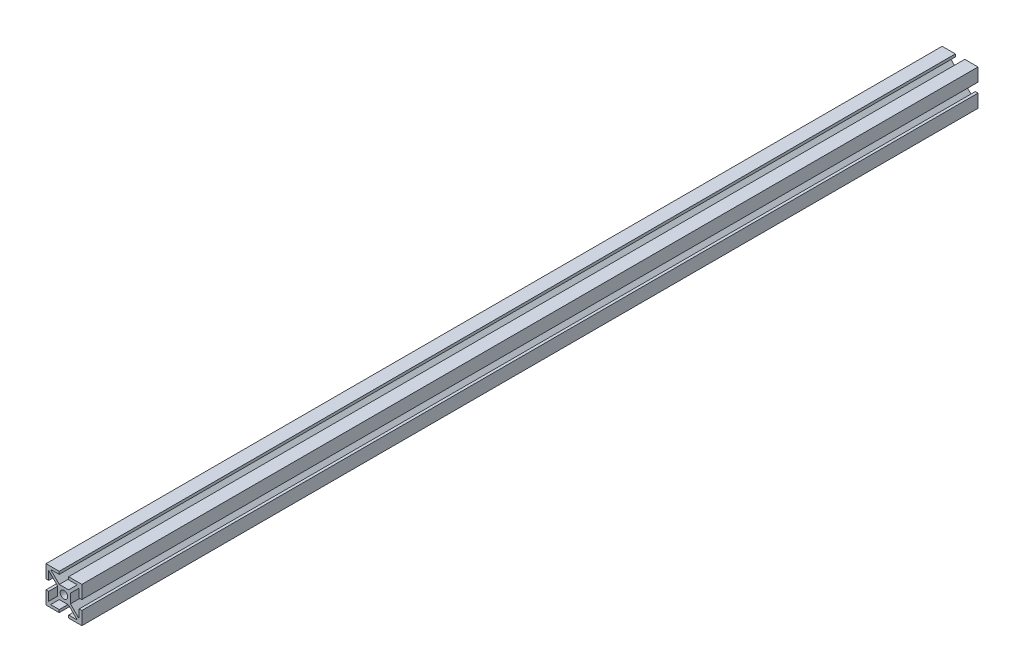
from build123d import *

# Parameters (mm, degrees)
SKETCH1_R           = 2.095
BOSS_EXTRUDE1_DEPTH = 500


with BuildPart() as part:
    # Sketch1 → Boss-Extrude1 (new body)
    with BuildSketch(Plane.XY):
        Polygon((6.345, 12.594339828), (1.5, 17.439339828), (1.5, 12.63), (0, 12.63), (0, 20), (7.37, 20), (7.37, 18.5), (2.560660172, 18.5), (7.405660172, 13.655), (12.594339828, 13.655), (17.439339828, 18.5), (12.63, 18.5), (12.63, 20), (20, 20), (20, 12.63), (18.5, 12.63), (18.5, 17.439339828), (13.655, 12.594339828), (13.655, 7.405660172), (18.5, 2.560660172), (18.5, 7.37), (20, 7.37), (20, 0), (12.63, 0), (12.63, 1.5), (17.439339828, 1.5), (12.594339828, 6.345), (7.405660172, 6.345), (2.560660172, 1.5), (7.37, 1.5), (7.37, 0), (0, 0), (0, 7.37), (1.5, 7.37), (1.5, 2.560660172), (6.345, 7.405660172), align=None)
        with Locations((10, 10)):
            Circle(SKETCH1_R, mode=Mode.SUBTRACT)
    extrude(amount=BOSS_EXTRUDE1_DEPTH)


solid = part.part
